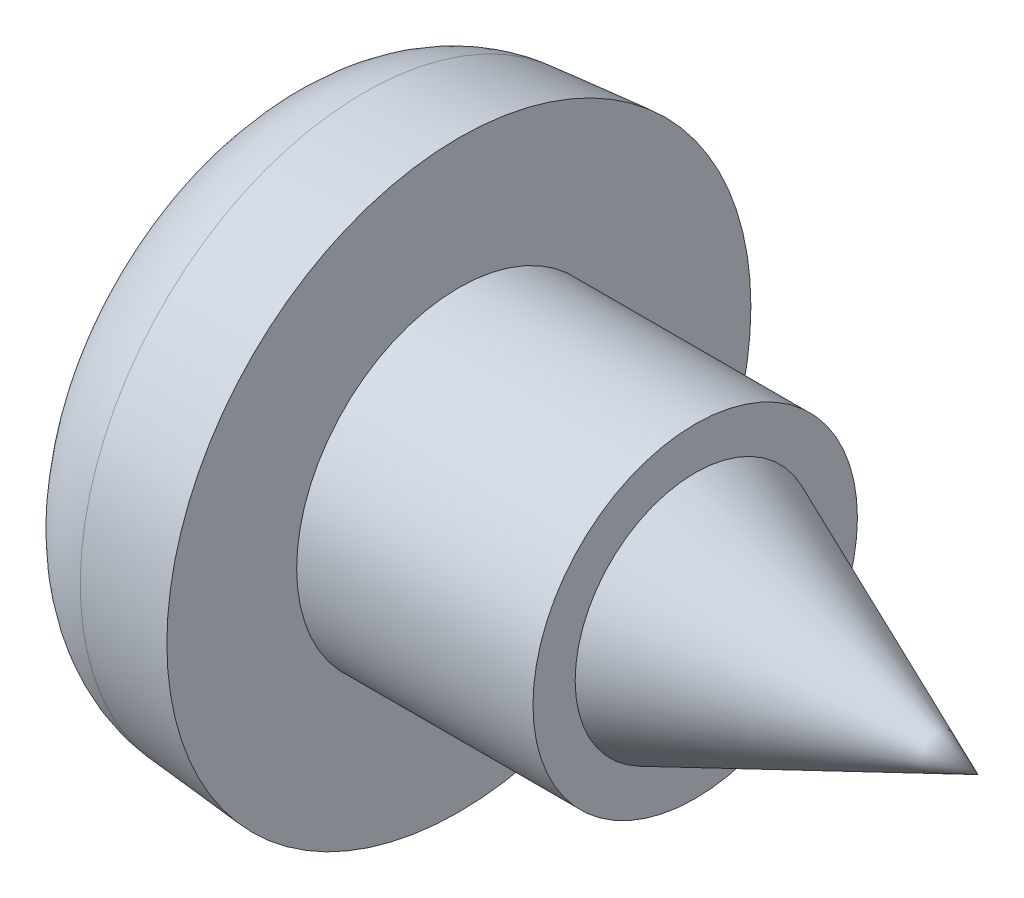
from build123d import *

# Parameters (mm, degrees)
CUT_EXTRUDE1_DEPTH = 1.65


with BuildPart() as part:
    # Sketch1 → Revolve1 (revolve)
    with BuildSketch(Plane.XY, mode=Mode.PRIVATE) as revolve1_sk:
        with BuildLine():
            Line((-1.462050681, 4.37208714), (0, 4.5))
            Line((0, 4.5), (0, 2.5))
            Line((0, 2.5), (3.641673123, 2.5))
            Line((3.641673123, 2.5), (3.641673123, 1.85))
            Line((3.641673123, 1.85), (8, 0))
            Line((8, 0), (-3.3, 0))
            ThreePointArc((-3.3, 0), (-3.190657425, 1.617218351), (-2.864619959, 3.205))
            ThreePointArc((-2.864619959, 3.205), (-2.346005844, 4.008071364), (-1.462050681, 4.37208714))
        make_face()
    revolve(revolve1_sk.sketch.rotate(Axis((-3.3, 0, 0), (1, 0, 0)), 180), axis=Axis((-3.3, 0, 0), (1, 0, 0)))

    # Sketch2 → Cut-Extrude1 (cut)
    with BuildSketch(Plane(origin=(-3.3, 0, 0), x_dir=(0, 0, -1), z_dir=(1, 0, 0))):
        with BuildLine():
            Line((0.6, 1.5), (0.6, 2.45))
            Line((0.6, 2.45), (-0.6, 2.45))
            Line((-0.6, 2.45), (-0.6, 1.5))
            ThreePointArc((-0.6, 1.5), (-0.863603897, 0.863603897), (-1.5, 0.6))
            Line((-1.5, 0.6), (-2.45, 0.6))
            Line((-2.45, 0.6), (-2.45, -0.6))
            Line((-2.45, -0.6), (-1.5, -0.6))
            ThreePointArc((-1.5, -0.6), (-0.863603897, -0.863603897), (-0.6, -1.5))
            Line((-0.6, -1.5), (-0.6, -2.45))
            Line((-0.6, -2.45), (0.6, -2.45))
            Line((0.6, -2.45), (0.6, -1.5))
            ThreePointArc((0.6, -1.5), (0.863603897, -0.863603897), (1.5, -0.6))
            Line((1.5, -0.6), (2.45, -0.6))
            Line((2.45, -0.6), (2.45, 0.6))
            Line((2.45, 0.6), (1.5, 0.6))
            ThreePointArc((1.5, 0.6), (0.863603897, 0.863603897), (0.6, 1.5))
        make_face()
    extrude(amount=CUT_EXTRUDE1_DEPTH, mode=Mode.SUBTRACT)


solid = part.part
